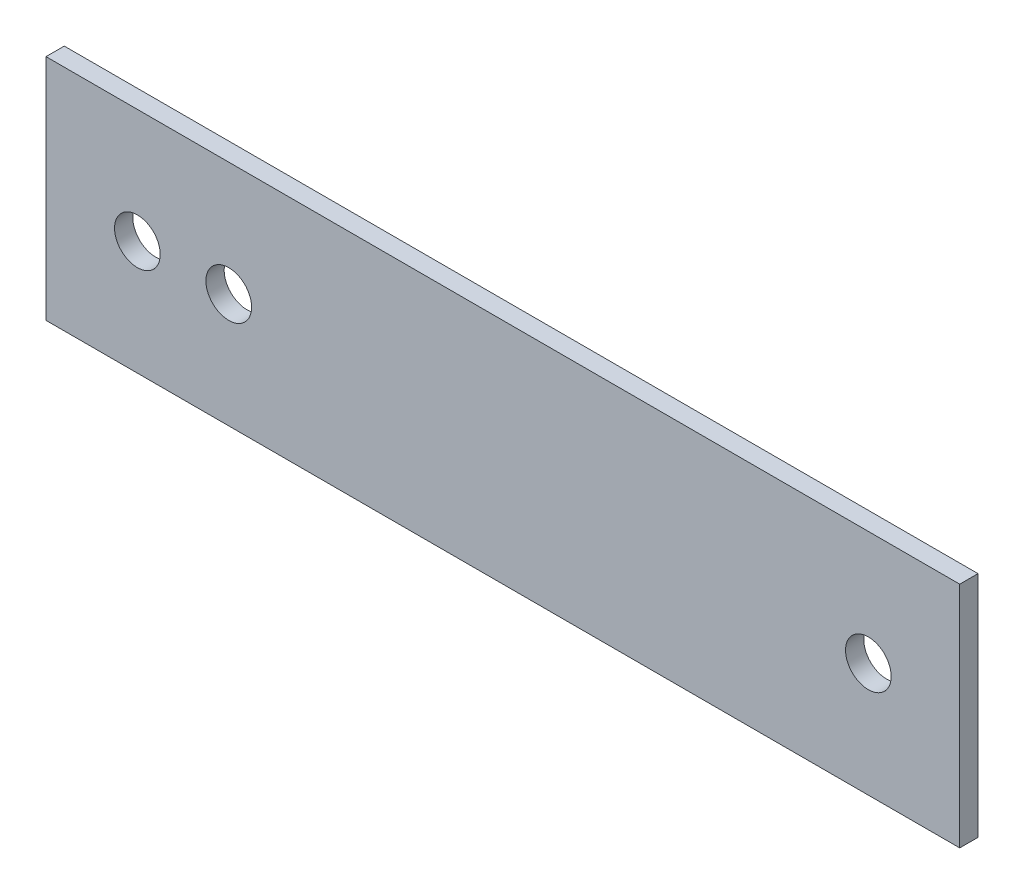
from build123d import *

# Parameters (mm, degrees)
ESBO_O1_W                = 100
ESBO_O1_H                = 25
ESBO_O1_R                = 2.5
RESSALTO_EXTRUS_O1_DEPTH = 2


with BuildPart() as part:
    # Esboço1 → Ressalto-extrusão1 (new body)
    with BuildSketch(Plane.XY):
        with Locations((21.110395733, -2.804487179)):
            Rectangle(ESBO_O1_W, ESBO_O1_H)
        with Locations((-18.889604267, -2.804487179)):
            Circle(ESBO_O1_R, mode=Mode.SUBTRACT)
        with Locations((-8.889604267, -2.804487179)):
            Circle(ESBO_O1_R, mode=Mode.SUBTRACT)
        with Locations((61.110395733, -2.804487179)):
            Circle(ESBO_O1_R, mode=Mode.SUBTRACT)
    extrude(amount=RESSALTO_EXTRUS_O1_DEPTH)


solid = part.part
